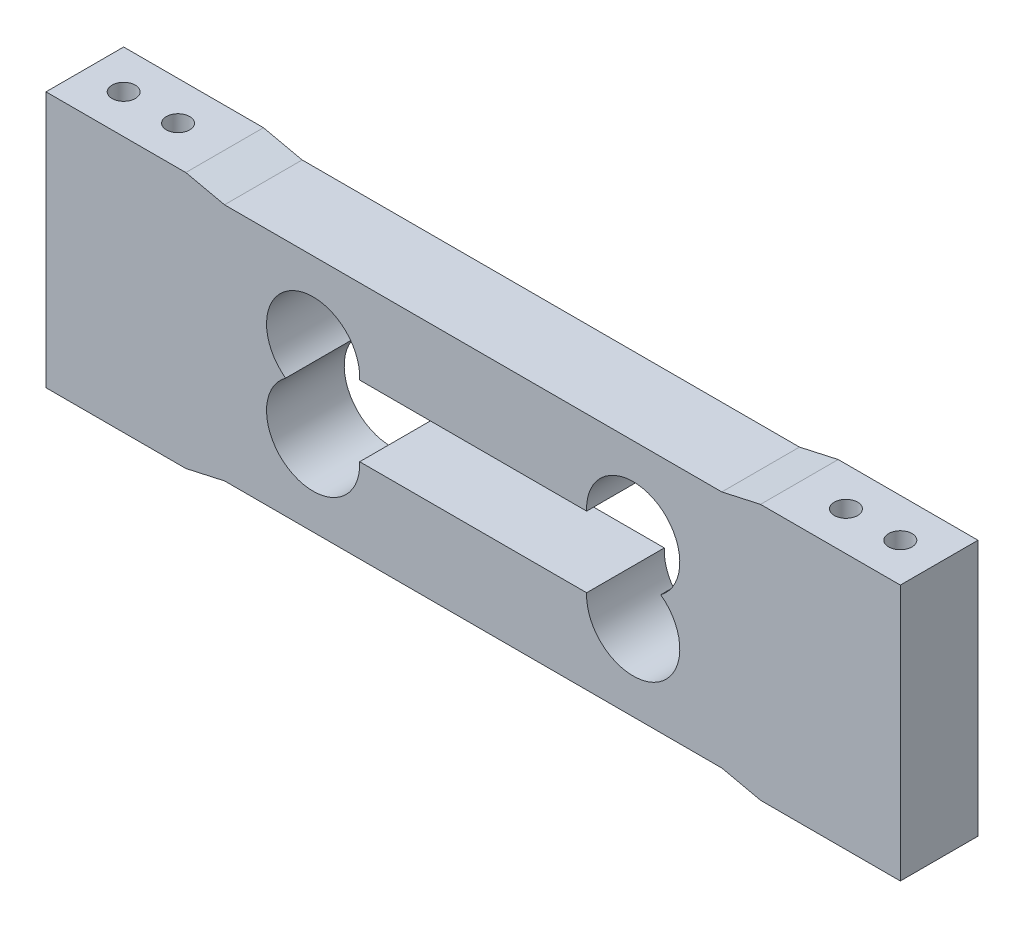
from build123d import *

# Parameters (mm, degrees)
BOSS_EXTRUDE1_DEPTH = 5
SKETCH3_R           = 1.5
CUT_EXTRUDE1_DEPTH  = 65.335060426


with BuildPart() as part:
    # Sketch1 → Boss-Extrude1 (new, symmetric)
    with BuildSketch(Plane.XY):
        Polygon((-55, 16.5), (-37, 16.5), (-32.015833371, 15.395447006), (32.015833371, 15.395447006), (37, 16.5), (55, 16.5), (55, -16.5), (37, -16.5), (32.015833371, -15.395447006), (-32.015833371, -15.395447006), (-37, -16.5), (-55, -16.5), align=None)
        with BuildLine():
            Line((-14.610208109, 4.550286626), (14.610208109, 4.550286626))
            ThreePointArc((14.610208109, 4.550286626), (23.186065182, 10.254148163), (24.151366397, 0))
            ThreePointArc((24.151366397, 0), (23.186065182, -10.254148163), (14.610208109, -4.550286626))
            Line((14.610208109, -4.550286626), (-14.610208109, -4.550286626))
            ThreePointArc((-14.610208109, -4.550286626), (-23.186065182, -10.254148163), (-24.151366397, 0))
            ThreePointArc((-24.151366397, 0), (-23.186065182, 10.254148163), (-14.610208109, 4.550286626))
        make_face(mode=Mode.SUBTRACT)
    extrude(amount=BOSS_EXTRUDE1_DEPTH, both=True)

    # Sketch3 → Cut-Extrude1 (cut, through all)
    with BuildSketch(Plane(origin=(0, 16.5, 0), x_dir=(1, 0, 0), z_dir=(0, 1, 0))):
        with Locations(Location((-50, 0, 0), (0, 0, 180))):
            Circle(SKETCH3_R)
        with Locations(Location((-43, 0, 0), (0, 0, 180))):
            Circle(SKETCH3_R)
        with Locations(Location((43, 0, 0), (0, 0, 180))):
            Circle(SKETCH3_R)
        with Locations(Location((50, 0, 0), (0, 0, 180))):
            Circle(SKETCH3_R)
    extrude(amount=-CUT_EXTRUDE1_DEPTH, mode=Mode.SUBTRACT)


solid = part.part
